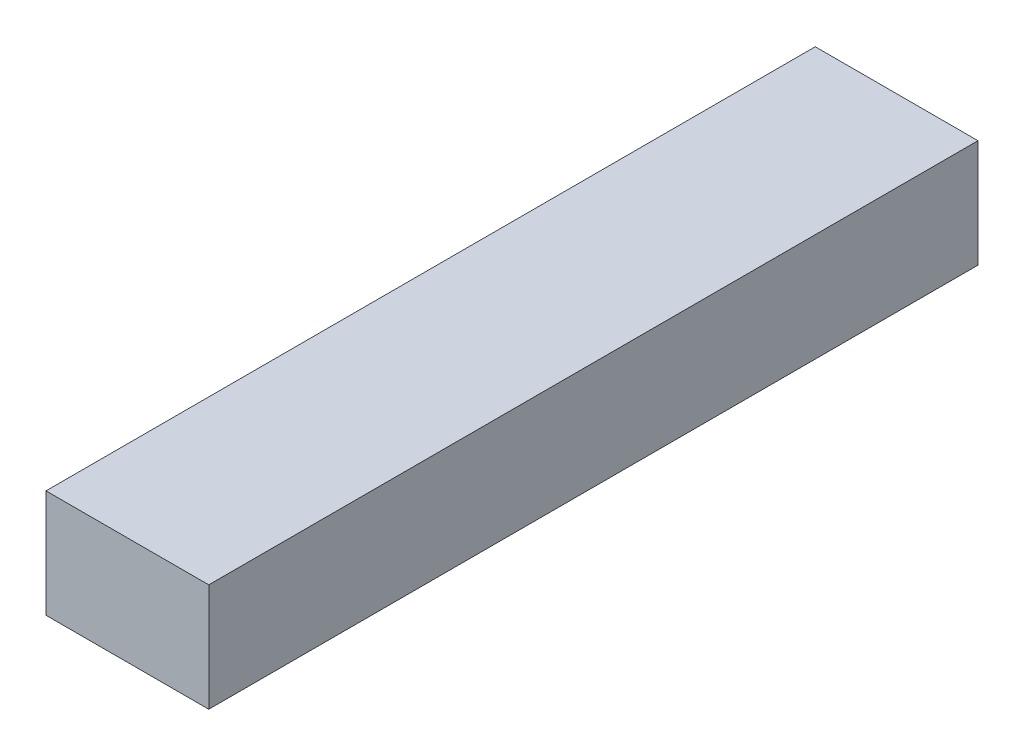
from build123d import *

# Parameters (mm, degrees)
SKETCH1_W           = 44.75
SKETCH1_H           = 29.63
BOSS_EXTRUDE1_DEPTH = 211.5


with BuildPart() as part:
    # Sketch1 → Boss-Extrude1 (new body)
    with BuildSketch(Plane.XY):
        Rectangle(SKETCH1_W, SKETCH1_H)
    extrude(amount=BOSS_EXTRUDE1_DEPTH)


solid = part.part
